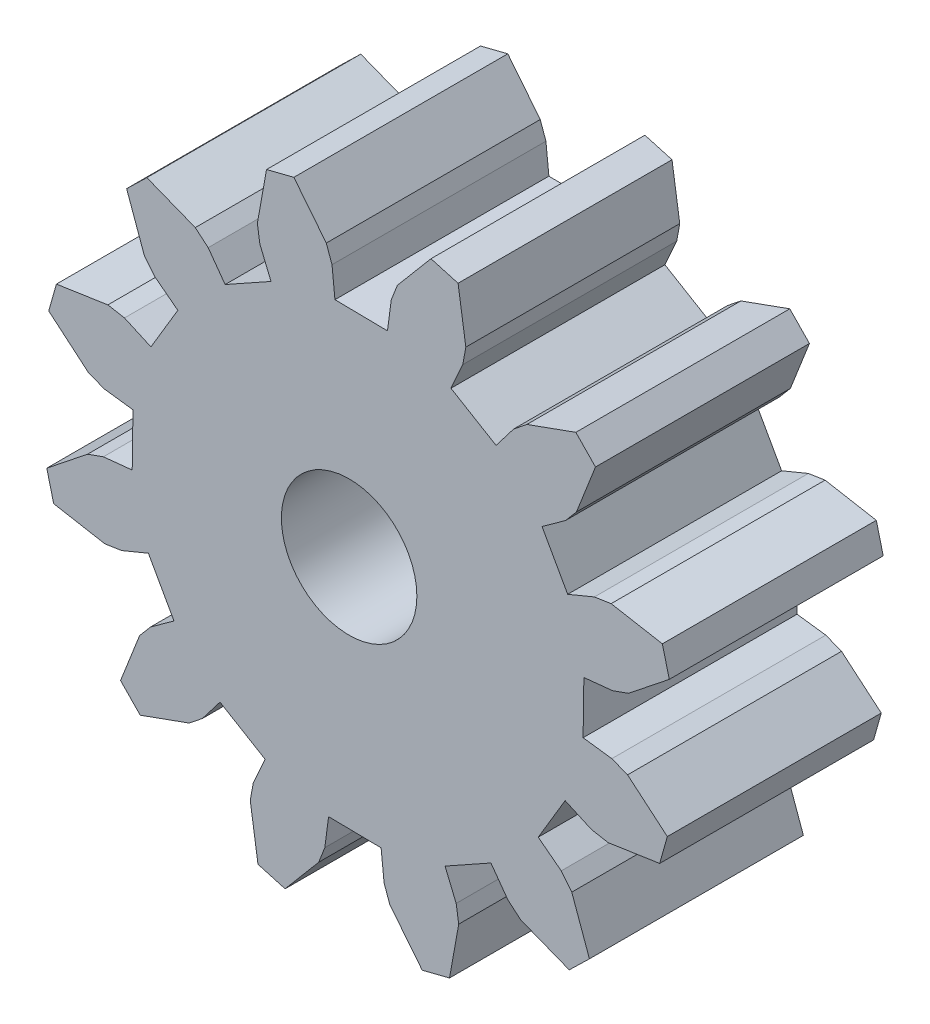
from build123d import *

# Parameters (mm, degrees)
BOSS_EXTRUDE1_DEPTH = 3
SKETCH2_R           = 0.95
CUT_EXTRUDE1_DEPTH  = 3


with BuildPart() as part:
    # Model → Boss-Extrude1 (new body)
    with BuildSketch(Plane.XY):
        Polygon((3.28114864, -0.553591744), (3.683973872, -0.606311596), (3.904576525, -0.692596416), (4.46233576, -1.16335455), (4.354682595, -1.543555198), (3.63291812, -1.652020067), (3.399826682, -1.609842083), (3.029159111, -1.443549864), (2.651791815, -2.076361715), (2.974290661, -2.323428597), (3.122197977, -2.508452992), (3.369848791, -3.195022478), (3.08652147, -3.47046279), (2.407220835, -3.20351854), (2.226450258, -3.050441439), (1.98859116, -2.721092688), (1.345375685, -3.080440385), (1.501144473, -3.455651839), (1.536726867, -3.689840852), (1.407911756, -4.40825247), (1.024820816, -4.505118707), (0.570002205, -3.934287195), (0.489986205, -3.711334195), (0.448670194, -3.307180093), (-0.288044489, -3.296769041), (-0.340764213, -3.69959429), (-0.427049372, -3.92019681), (-0.897807506, -4.477956045), (-1.278008415, -4.370303805), (-1.386473285, -3.64853933), (-1.344295476, -3.415447861), (-1.178003257, -3.04478029), (-1.810815108, -2.667412994), (-2.05788199, -2.98991184), (-2.242905897, -3.137819766), (-2.929475702, -3.385469696), (-3.204916014, -3.102142375), (-2.937971765, -2.422841739), (-2.784894663, -2.242071162), (-2.455545912, -2.004212065), (-2.814890389, -1.360994791), (-3.190106124, -1.516753266), (-3.424295137, -1.55233566), (-4.142706929, -1.423521518), (-4.239572929, -1.040430518), (-3.668740929, -0.585612518), (-3.445787929, -0.505596518), (-3.041633929, -0.464279518), (-3.031233208, 0.272435311), (-3.434058457, 0.325155035), (-3.65466111, 0.411439855), (-4.212419929, 0.882198482), (-4.104767689, 1.262399392), (-3.383003067, 1.370863283), (-3.149911423, 1.328686443), (-2.779244225, 1.162393392), (-2.401877369, 1.795205505), (-2.724376698, 2.042271757), (-2.872284136, 2.227296053), (-3.119934385, 2.913865744), (-2.836607064, 3.189306056), (-2.157306429, 2.922361806), (-1.976536269, 2.769284211), (-1.738676514, 2.439935935), (-1.09545924, 2.799280412), (-1.251217361, 3.174496294), (-1.286799755, 3.408685307), (-1.157985613, 4.127097098), (-0.774894613, 4.223963098), (-0.320076613, 3.653131098), (-0.240060613, 3.430178098), (-0.198743613, 3.026024098), (0.53797107, 3.015613046), (0.590690923, 3.418438278), (0.676975742, 3.639040931), (1.147733877, 4.196800166), (1.527934524, 4.089147), (1.636398415, 3.367382378), (1.5942214, 3.134290766), (1.427928349, 2.763623568), (2.060740462, 2.386256712), (2.307806714, 2.708756041), (2.492831498, 2.856662868), (3.179400869, 3.104314002), (3.454841181, 2.820986681), (3.187896932, 2.141686046), (3.03481983, 1.960915469), (2.705471079, 1.723056371), (3.064815556, 1.079839097), (3.440031438, 1.235597218), (3.674220451, 1.271179612), (4.392632069, 1.142364502), (4.489498306, 0.759273562), (3.918666794, 0.30445495), (3.695713794, 0.22443895), (3.291559693, 0.18312294), align=None)
    extrude(amount=BOSS_EXTRUDE1_DEPTH)

    # Sketch2 → Cut-Extrude1 (cut)
    with BuildSketch(Plane.XY.offset(3)):
        Circle(SKETCH2_R)
    extrude(amount=-CUT_EXTRUDE1_DEPTH, mode=Mode.SUBTRACT)


solid = part.part
